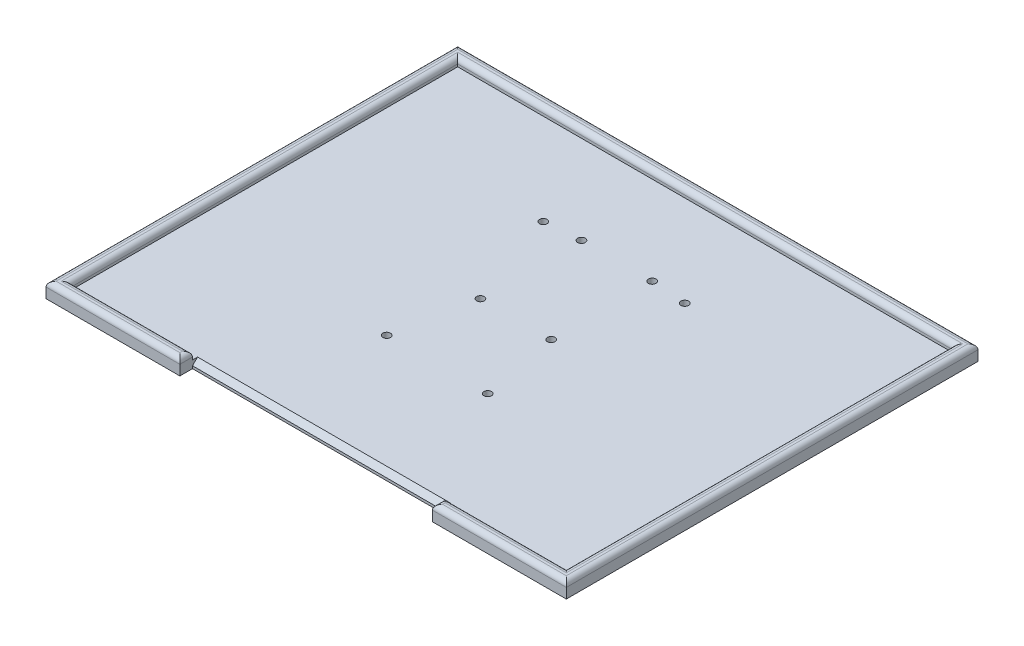
from build123d import *

# Parameters (mm, degrees)
CROQUIS1_W              = 206
CROQUIS1_H              = 163
SALIENTE_EXTRUIR1_DEPTH = 3
CROQUIS2_W              = 206
CROQUIS2_H              = 163
CROQUIS2_W_2            = 196
CROQUIS2_H_2            = 153
SALIENTE_EXTRUIR2_DEPTH = 3
CROQUIS3_W              = 100
CROQUIS3_H              = 5
CORTAR_EXTRUIR1_DEPTH   = 10
REDONDEO2_R             = 2
CHAFL_N1_SIZE           = 2
CROQUIS4_R              = 1.5
CORTAR_EXTRUIR3_DEPTH   = 10
CROQUIS5_R              = 1.5
CORTAR_EXTRUIR4_DEPTH   = 10


with BuildPart() as part:
    # Croquis1 → Saliente-Extruir1 (new body)
    with BuildSketch(Plane(origin=(0, 0, 0), x_dir=(1, 0, 0), z_dir=(0, 1, 0))):
        with Locations((103, 81.5)):
            Rectangle(CROQUIS1_W, CROQUIS1_H)
    extrude(amount=SALIENTE_EXTRUIR1_DEPTH)

    # Croquis2 → Saliente-Extruir2 (add)
    with BuildSketch(Plane(origin=(0, 3, 0), x_dir=(1, 0, 0), z_dir=(0, 1, 0))):
        with Locations((103, 81.5)):
            Rectangle(CROQUIS2_W, CROQUIS2_H)
        with Locations((103, 81.5)):
            Rectangle(CROQUIS2_W_2, CROQUIS2_H_2, mode=Mode.SUBTRACT)
    extrude(amount=SALIENTE_EXTRUIR2_DEPTH)

    # Croquis3 → Cortar-Extruir1 (cut)
    with BuildSketch(Plane(origin=(0, 6, 0), x_dir=(1, 0, 0), z_dir=(0, 1, 0))):
        with Locations((103, 2.5)):
            Rectangle(CROQUIS3_W, CROQUIS3_H)
    extrude(amount=-CORTAR_EXTRUIR1_DEPTH, mode=Mode.SUBTRACT)

    # Redondeo2
    redondeo2_edges = [part.edges().sort_by_distance(p)[0] for p in [
        (103, 6, -163),
        (26.5, 6, 0),
        (0, 6, -81.5),
        (201, 6, -81.5),
        (103, 6, -158),
        (5, 6, -81.5),
        (206, 6, -81.5),
        (29, 6, -5),
        (177, 6, -5),
        (179.5, 6, 0),
        (53, 6, -2.5),
        (153, 6, -2.5),
    ]]
    fillet(redondeo2_edges, radius=REDONDEO2_R)

    # Chaflán1
    chafl_n1_edges = [part.edges().sort_by_distance(p)[0] for p in [
        (103, 3, -5),
    ]]
    chamfer(chafl_n1_edges, length=CHAFL_N1_SIZE)

    # Croquis4 → Cortar-Extruir3 (cut)
    with BuildSketch(Plane(origin=(0, 3, 0), x_dir=(1, 0, 0), z_dir=(0, 1, 0))):
        with Locations(Location((123, 51.88030089, 0), (0, 0, 270))):
            Circle(CROQUIS4_R)
        with Locations(Location((83, 51.88030089, 0), (0, 0, 270))):
            Circle(CROQUIS4_R)
        with Locations(Location((75, 121.88030089, 0), (0, 0, 270))):
            Circle(CROQUIS4_R)
        with Locations(Location((131, 121.88030089, 0), (0, 0, 270))):
            Circle(CROQUIS4_R)
    extrude(amount=-CORTAR_EXTRUIR3_DEPTH, mode=Mode.SUBTRACT)

    # Croquis5 → Cortar-Extruir4 (cut)
    with BuildSketch(Plane(origin=(0, 3, 0), x_dir=(1, 0, 0), z_dir=(0, 1, 0))):
        with Locations(Location((89, 123, 0), (0, 0, 270))):
            Circle(CROQUIS5_R)
        with Locations(Location((117, 123, 0), (0, 0, 270))):
            Circle(CROQUIS5_R)
        with Locations(Location((89, 83, 0), (0, 0, 270))):
            Circle(CROQUIS5_R)
        with Locations(Location((117, 83, 0), (0, 0, 270))):
            Circle(CROQUIS5_R)
    extrude(amount=-CORTAR_EXTRUIR4_DEPTH, mode=Mode.SUBTRACT)


solid = part.part
